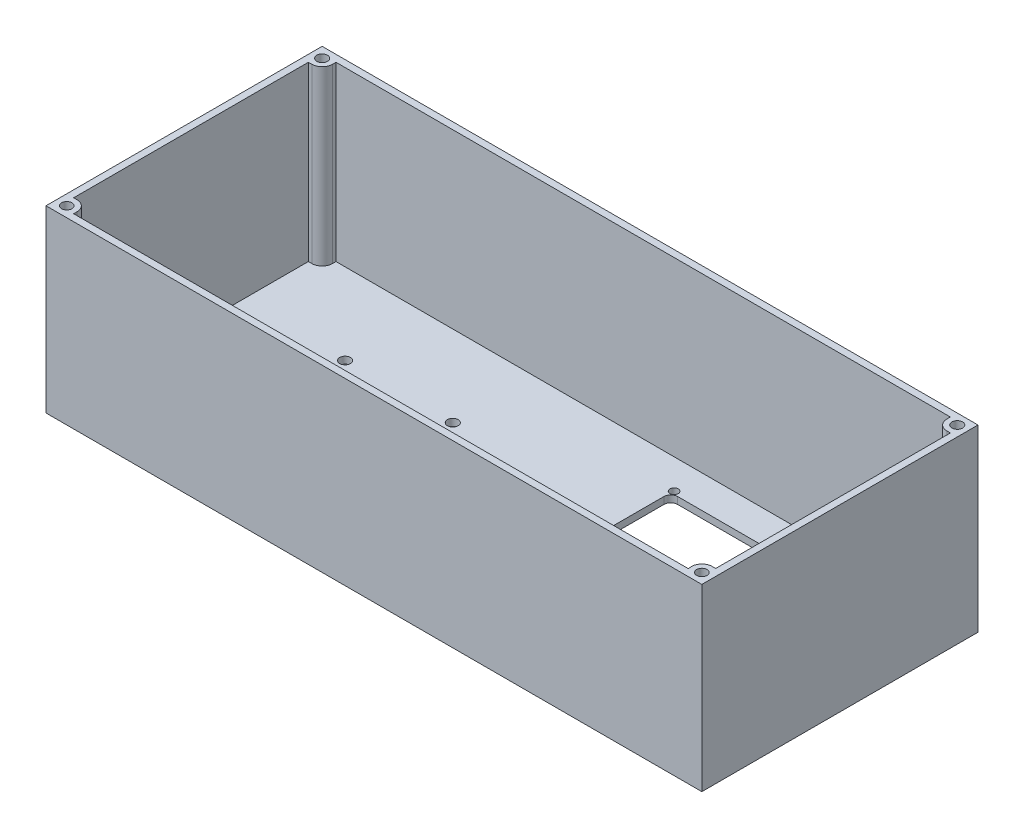
from build123d import *

# Parameters (mm, degrees)
SKETCH1_W           = 190
SKETCH1_H           = 80
BOSS_EXTRUDE1_DEPTH = 2
SKETCH2_W           = 190
SKETCH2_H           = 80
SKETCH2_R           = 1.5
SKETCH2_R_2         = 1.55
BOSS_EXTRUDE2_DEPTH = 50
SKETCH3_R           = 1.2
SKETCH3_R_2         = 1.55
SKETCH3_W           = 34.1
SKETCH3_H           = 23.1
CUT_EXTRUDE1_DEPTH  = 127.586332253


with BuildPart() as part:
    # Sketch1 → Boss-Extrude1 (new body)
    with BuildSketch(Plane(origin=(0, 0, 0), x_dir=(1, 0, 0), z_dir=(0, 1, 0))):
        with Locations((7.511627907, 13.023255814)):
            Rectangle(SKETCH1_W, SKETCH1_H)
    extrude(amount=BOSS_EXTRUDE1_DEPTH)

    # Sketch2 → Boss-Extrude2 (add)
    with BuildSketch(Plane(origin=(0, 2, 0), x_dir=(1, 0, 0), z_dir=(0, 1, 0))):
        with Locations((7.511627907, 13.023255814)):
            Rectangle(SKETCH2_W, SKETCH2_H)
        with Locations(Location((-84.488372093, -23.976744186, 0), (0, 0, 270))):
            Circle(SKETCH2_R, mode=Mode.SUBTRACT)
        with Locations(Location((99.511627907, -23.976744186, 0), (0, 0, 270))):
            Circle(SKETCH2_R, mode=Mode.SUBTRACT)
        with Locations(Location((99.511627907, 50.023255814, 0), (0, 0, 270))):
            Circle(SKETCH2_R_2, mode=Mode.SUBTRACT)
        with Locations(Location((-84.488372093, 50.023255814, 0), (0, 0, 270))):
            Circle(SKETCH2_R_2, mode=Mode.SUBTRACT)
        with BuildLine():
            Line((-81.488372093, -23.976744186), (-81.488372093, -24.976744186))
            Line((-81.488372093, -24.976744186), (96.683200782, -24.976744186))
            ThreePointArc((96.683200782, -24.976744186), (97.062138164, -22.244693378), (99.511627907, -20.976744186))
            Line((99.511627907, -20.976744186), (100.511627907, -20.976744186))
            Line((100.511627907, -20.976744186), (100.511627907, 47.023255814))
            Line((100.511627907, 47.023255814), (99.511627907, 47.023255814))
            ThreePointArc((99.511627907, 47.023255814), (97.390307563, 47.90193547), (96.511627907, 50.023255814))
            Line((96.511627907, 50.023255814), (96.511627907, 51.023255814))
            Line((96.511627907, 51.023255814), (-81.488372093, 51.023255814))
            Line((-81.488372093, 51.023255814), (-81.488372093, 50.023255814))
            ThreePointArc((-81.488372093, 50.023255814), (-82.367051749, 47.90193547), (-84.488372093, 47.023255814))
            Line((-84.488372093, 47.023255814), (-85.488372093, 47.023255814))
            Line((-85.488372093, 47.023255814), (-85.488372093, -20.976744186))
            Line((-85.488372093, -20.976744186), (-84.488372093, -20.976744186))
            ThreePointArc((-84.488372093, -20.976744186), (-82.367051749, -21.855423842), (-81.488372093, -23.976744186))
        make_face(mode=Mode.SUBTRACT)
    extrude(amount=BOSS_EXTRUDE2_DEPTH)

    # Sketch3 → Cut-Extrude1 (cut, through all)
    with BuildSketch(Plane.XZ):
        with Locations(Location((25.111627907, 16.326744186, 0), (0, 0, 270))):
            Circle(SKETCH3_R)
        with Locations(Location((84.911627907, 16.326744186, 0), (0, 0, 270))):
            Circle(SKETCH3_R)
        with Locations(Location((25.111627907, -42.373255814, 0), (0, 0, 270))):
            Circle(SKETCH3_R)
        with Locations(Location((84.911627907, -42.373255814, 0), (0, 0, 270))):
            Circle(SKETCH3_R)
        with Locations(Location((-55.338372093, 1.776744186, 0), (0, 0, 270))):
            Circle(SKETCH3_R_2)
        with Locations(Location((-24.138372093, 1.776744186, 0), (0, 0, 270))):
            Circle(SKETCH3_R_2)
        with Locations(Location((-55.338372093, -27.523255814, 0), (0, 0, 270))):
            Circle(SKETCH3_R_2)
        with Locations(Location((-24.138372093, -27.523255814, 0), (0, 0, 270))):
            Circle(SKETCH3_R_2)
        with BuildLine():
            Line((26.961627907, 15.526744186), (83.061627907, 15.526744186))
            ThreePointArc((83.061627907, 15.526744186), (84.475841469, 14.940957748), (85.061627907, 13.526744186))
            Line((85.061627907, 13.526744186), (85.061627907, -39.573255814))
            ThreePointArc((85.061627907, -39.573255814), (84.475841469, -40.987469376), (83.061627907, -41.573255814))
            Line((83.061627907, -41.573255814), (26.961627907, -41.573255814))
            ThreePointArc((26.961627907, -41.573255814), (25.547414345, -40.987469376), (24.961627907, -39.573255814))
            Line((24.961627907, -39.573255814), (24.961627907, 13.526744186))
            ThreePointArc((24.961627907, 13.526744186), (25.547414345, 14.940957748), (26.961627907, 15.526744186))
        make_face()
        with Locations((-39.738372093, -13.043255814)):
            Rectangle(SKETCH3_W, SKETCH3_H)
    extrude(amount=-CUT_EXTRUDE1_DEPTH, mode=Mode.SUBTRACT)


solid = part.part
